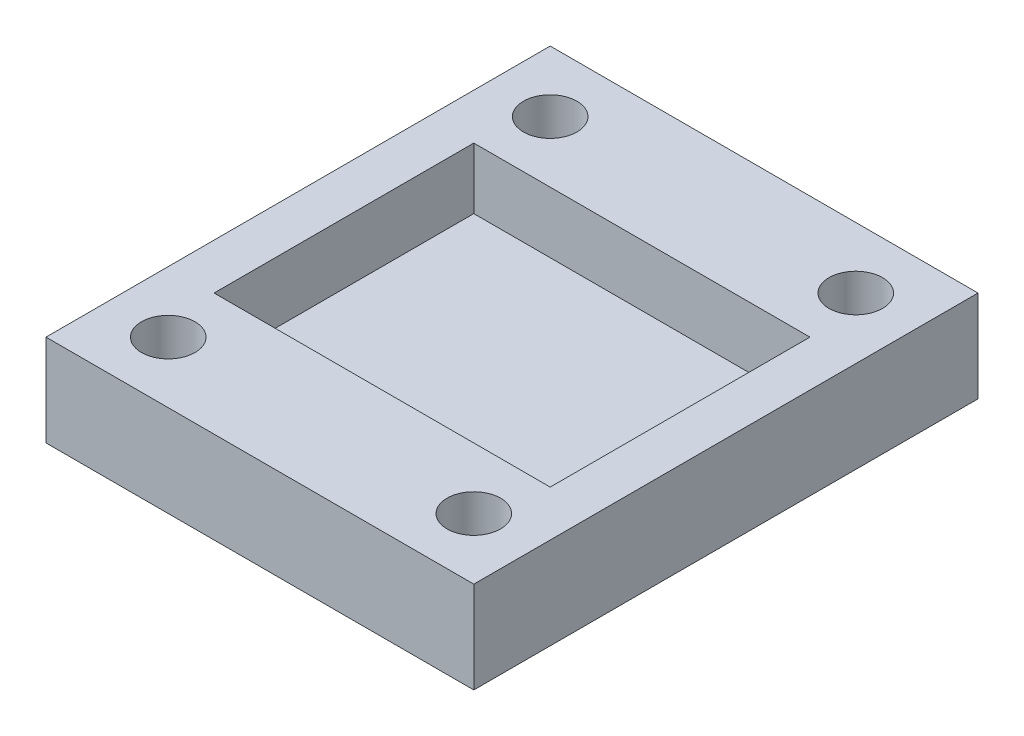
from build123d import *

# Parameters (mm, degrees)
SKETCH1_W           = 22
SKETCH1_H           = 17
BOSS_EXTRUDE1_DEPTH = 2
SKETCH1_3_W         = 28
SKETCH1_3_H         = 33
SKETCH1_3_R         = 1.75
SKETCH1_3_W_2       = 22
SKETCH1_3_H_2       = 17
BOSS_EXTRUDE2_DEPTH = 6


with BuildPart() as part:
    # Sketch1 → Boss-Extrude1 (new body)
    with BuildSketch(Plane(origin=(0, 0, 0), x_dir=(1, 0, 0), z_dir=(0, 1, 0))):
        with Locations((11, 8.5)):
            Rectangle(SKETCH1_W, SKETCH1_H)
    extrude(amount=BOSS_EXTRUDE1_DEPTH)

    # Sketch1<3> → Boss-Extrude2 (add)
    with BuildSketch(Plane(origin=(0, 0, 0), x_dir=(1, 0, 0), z_dir=(0, 1, 0))):
        with Locations((11, 8.5)):
            Rectangle(SKETCH1_3_W, SKETCH1_3_H)
        with Locations((21, -4)):
            Circle(SKETCH1_3_R, mode=Mode.SUBTRACT)
        with Locations((1, -4)):
            Circle(SKETCH1_3_R, mode=Mode.SUBTRACT)
        with Locations((21, 21)):
            Circle(SKETCH1_3_R, mode=Mode.SUBTRACT)
        with Locations((1, 21)):
            Circle(SKETCH1_3_R, mode=Mode.SUBTRACT)
        with Locations((11, 8.5)):
            Rectangle(SKETCH1_3_W_2, SKETCH1_3_H_2, mode=Mode.SUBTRACT)
    extrude(amount=BOSS_EXTRUDE2_DEPTH)


solid = part.part
